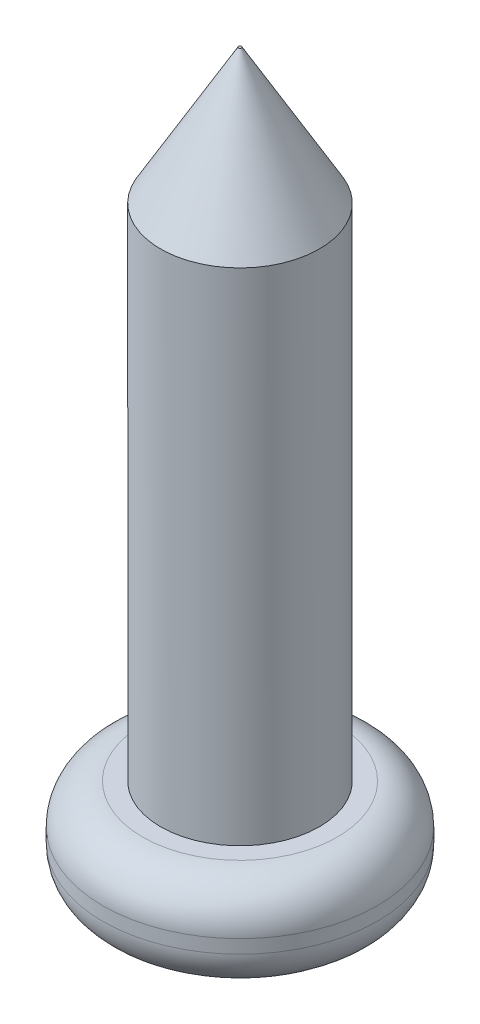
from build123d import *

# Parameters (mm, degrees)
SKETCH_1_R      = 1.725
EXTRUDE_1_DEPTH = 1.17
FILLET_1_R      = 0.5
SKETCH_2_R      = 1
EXTRUDE_2_DEPTH = 8
CHAMFER_1_SIZE  = 1.7
CHAMFER_1_SIZE2 = 0.981495458


with BuildPart() as part:
    # 草图1 → 凸台-拉伸1 (new body)
    with BuildSketch(Plane(origin=(0, 0, 0), x_dir=(1, 0, 0), z_dir=(0, 1, 0))):
        with Locations(Location((0, 0, 0), (0, 0, 90))):
            Circle(SKETCH_1_R)
    extrude(amount=EXTRUDE_1_DEPTH)

    # 圆角1
    fillet_1_edges = [part.edges().sort_by_distance(p)[0] for p in [
        (0, 0, 1.725),
        (0, 1.17, 1.725),
    ]]
    fillet(fillet_1_edges, radius=FILLET_1_R)

    # 草图2 → 凸台-拉伸2 (add)
    with BuildSketch(Plane(origin=(0, 1.17, 0), x_dir=(1, 0, 0), z_dir=(0, 1, 0))):
        with Locations(Location((0, 0, 0), (0, 0, 270))):
            Circle(SKETCH_2_R)
    extrude(amount=EXTRUDE_2_DEPTH)

    # 倒角1
    chamfer_1_edges = [part.edges().sort_by_distance(p)[0] for p in [
        (0, 9.17, -1),
    ]]
    chamfer_1_side = [part.faces().sort_by_distance(p)[0] for p in [
        (0, 5.17, -1),
    ]]
    chamfer(chamfer_1_edges, length=CHAMFER_1_SIZE, length2=CHAMFER_1_SIZE2, reference=chamfer_1_side[0])


solid = part.part
